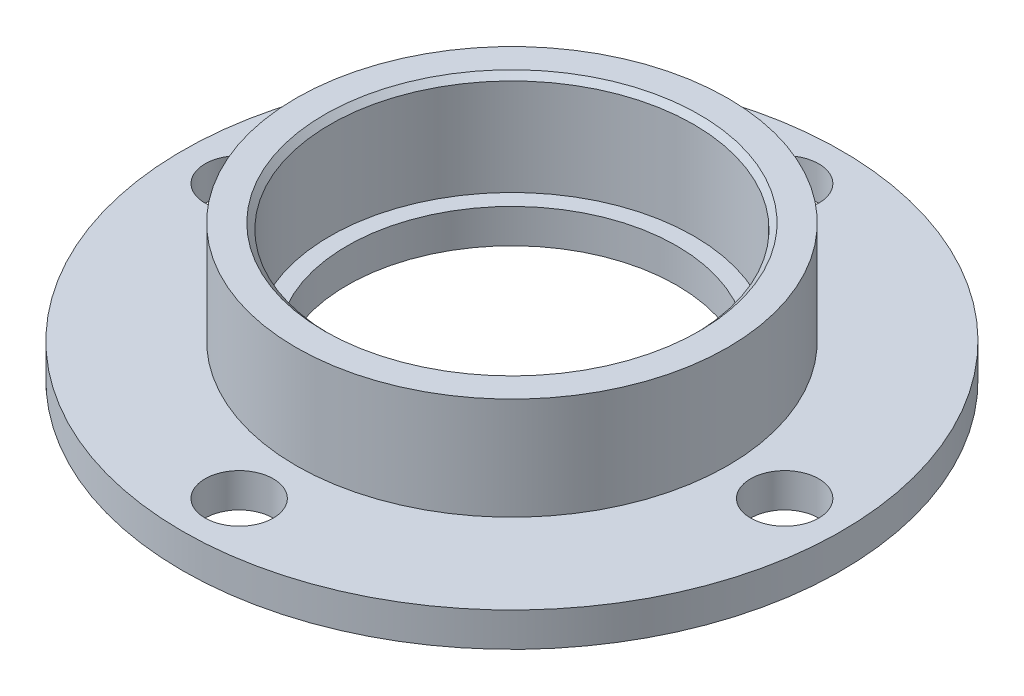
from build123d import *

# Parameters (mm, degrees)
SKETCH1_R             = 29
SKETCH1_R_2           = 14.5
SKETCH1_R_3           = 1
BOSS_EXTRUDE1_DEPTH   = 3
SKETCH2_R             = 19
SKETCH2_R_2           = 16
BOSS_EXTRUDE2_DEPTH   = 9
F_6_0MM_DOWEL_HOLE1_D = 6
CHAMFER1_SIZE         = 0.5


with BuildPart() as part:
    # Sketch1 → Boss-Extrude1 (new body)
    with BuildSketch(Plane(origin=(0, 0, 0), x_dir=(1, 0, 0), z_dir=(0, 1, 0))):
        with Locations(Location((0, 0, 0), (0, 0, 270))):
            Circle(SKETCH1_R)
        with Locations(Location((0, 0, 0), (0, 0, 270))):
            Circle(SKETCH1_R_2, mode=Mode.SUBTRACT)
        with Locations(Location((0, 24, 0), (0, 0, 270))):
            Circle(SKETCH1_R_3, mode=Mode.SUBTRACT)
        with Locations(Location((24, 0, 0), (0, 0, 270))):
            Circle(SKETCH1_R_3, mode=Mode.SUBTRACT)
        with Locations(Location((0, -24, 0), (0, 0, 270))):
            Circle(SKETCH1_R_3, mode=Mode.SUBTRACT)
        with Locations(Location((-24, 0, 0), (0, 0, 270))):
            Circle(SKETCH1_R_3, mode=Mode.SUBTRACT)
    extrude(amount=BOSS_EXTRUDE1_DEPTH)

    # Sketch2 → Boss-Extrude2 (add)
    with BuildSketch(Plane(origin=(0, 3, 0), x_dir=(1, 0, 0), z_dir=(0, 1, 0))):
        with Locations(Location((0, 0, 0), (0, 0, 270))):
            Circle(SKETCH2_R)
        with Locations(Location((0, 0, 0), (0, 0, 270))):
            Circle(SKETCH2_R_2, mode=Mode.SUBTRACT)
    extrude(amount=BOSS_EXTRUDE2_DEPTH)

    # Ø6.0mm Dowel Hole1 (through all)
    with Locations(Plane(origin=(0, 3, 0), x_dir=(1, 0, 0), z_dir=(0, 1, 0))):
        with Locations((0, 24), (24, 0), (0, -24), (-24, 0)):
            Hole(F_6_0MM_DOWEL_HOLE1_D / 2)

    # Chamfer1
    chamfer1_edges = [part.edges().sort_by_distance(p)[0] for p in [
        (0, 12, -16),
    ]]
    chamfer(chamfer1_edges, length=CHAMFER1_SIZE)


solid = part.part
